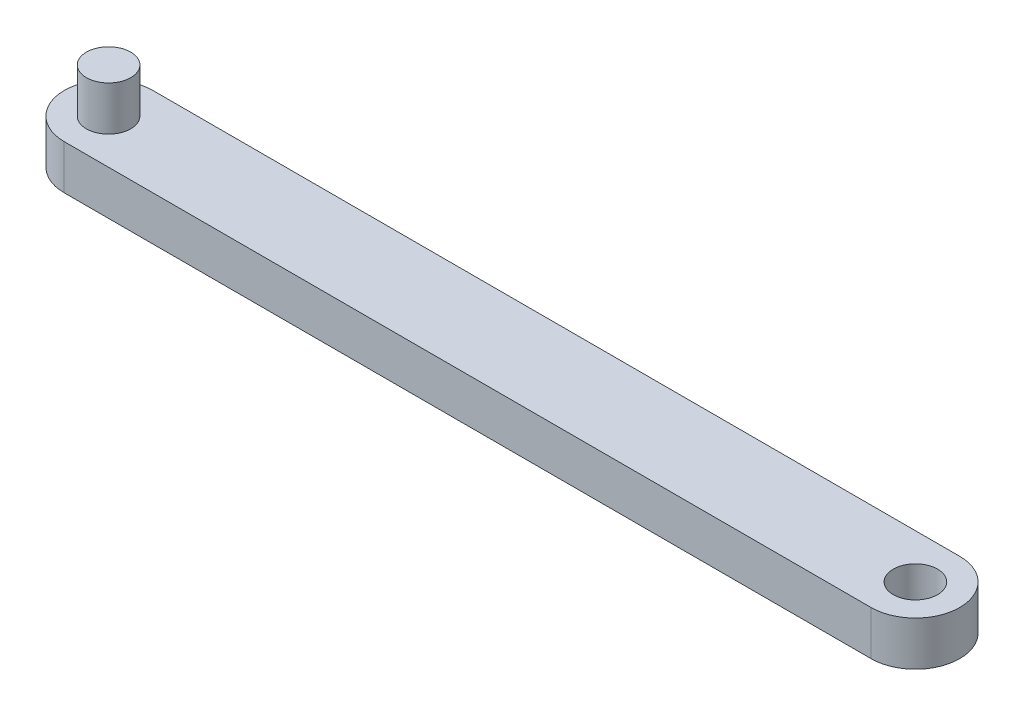
from build123d import *

# Parameters (mm, degrees)
SKETCH1_R                = 5
BOSS_EXTRUDE1_DEPTH      = 5
BOSS_EXTRUDE2_DEPTH      = 15
BOSS_EXTRUDE2_DEPTH_BACK = 5
SKETCH2_R                = 5


with BuildPart() as part:
    # Sketch1 → Boss-Extrude1 (new, symmetric)
    with BuildSketch(Plane(origin=(0, 0, 0), x_dir=(1, 0, 0), z_dir=(0, 1, 0))):
        with BuildLine():
            Line((-91, -10), (91, -10))
            ThreePointArc((91, -10), (101, 0), (91, 10))
            Line((91, 10), (-91, 10))
            ThreePointArc((-91, 10), (-101, 0), (-91, -10))
        make_face()
        with Locations(Location((-91, 0, 0), (0, 0, 270))):
            Circle(SKETCH1_R, mode=Mode.SUBTRACT)
        with Locations(Location((91, 0, 0), (0, 0, 270))):
            Circle(SKETCH1_R, mode=Mode.SUBTRACT)
    extrude(amount=BOSS_EXTRUDE1_DEPTH, both=True)

    # Sketch2 → Boss-Extrude2 (add, two sides: drawn at the far end of the back side and taken through both)
    with BuildSketch(Plane(origin=(0, 0, 0), x_dir=(1, 0, 0), z_dir=(0, 1, 0)).offset(-BOSS_EXTRUDE2_DEPTH_BACK)):
        with Locations(Location((-91, 0, 0), (0, 0, 270))):
            Circle(SKETCH2_R)
    extrude(amount=BOSS_EXTRUDE2_DEPTH + BOSS_EXTRUDE2_DEPTH_BACK)


solid = part.part
